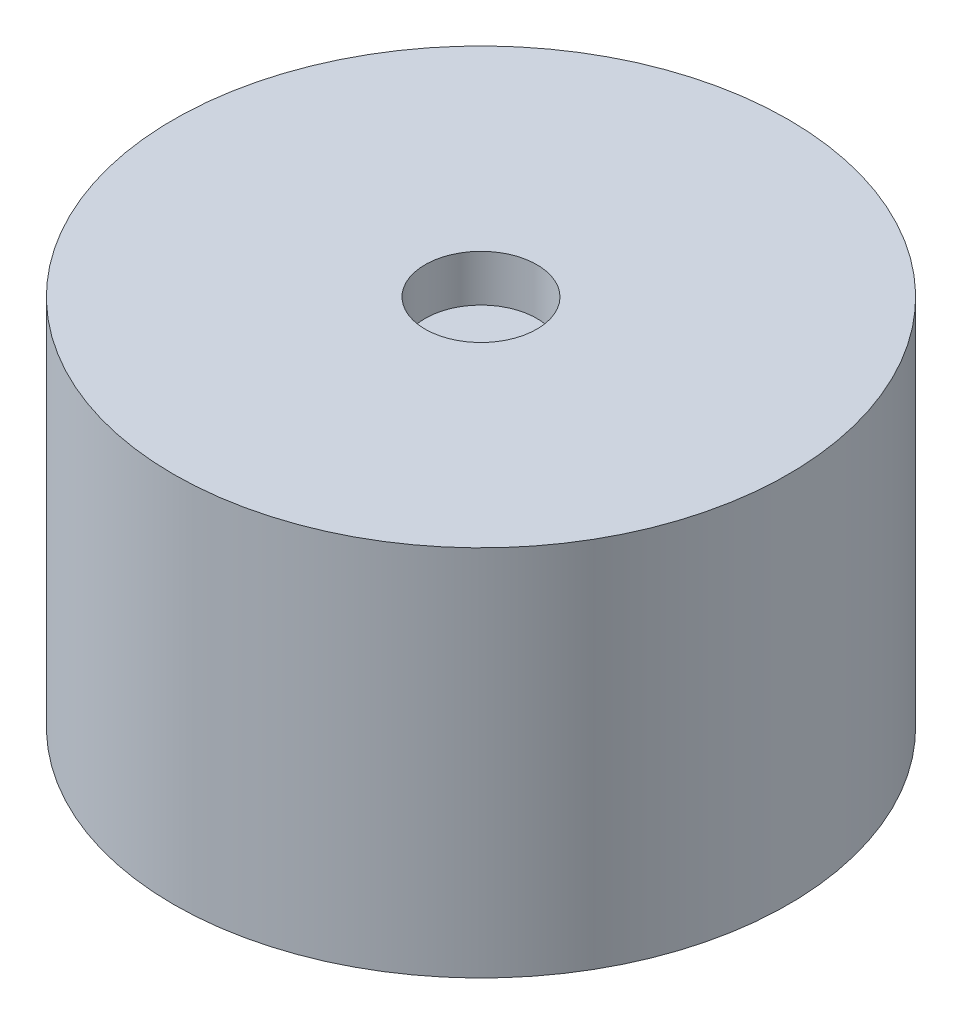
from build123d import *

# Parameters (mm, degrees)
SKETCH_1_R          = 33
EXTRUDE_1_DEPTH     = 40
SKETCH_2_R          = 6
CUT_EXTRUDE_1_DEPTH = 5


with BuildPart() as part:
    # 草图1 → 凸台-拉伸1 (new body)
    with BuildSketch(Plane(origin=(0, 0, 0), x_dir=(1, 0, 0), z_dir=(0, 1, 0))):
        with Locations(Location((0, 0, 0), (0, 0, 270))):
            Circle(SKETCH_1_R)
    extrude(amount=EXTRUDE_1_DEPTH)

    # 草图2 → 切除-拉伸1 (cut)
    with BuildSketch(Plane(origin=(0, 40, 0), x_dir=(1, 0, 0), z_dir=(0, 1, 0))):
        with Locations(Location((0, 0, 0), (0, 0, 270))):
            Circle(SKETCH_2_R)
    extrude(amount=-CUT_EXTRUDE_1_DEPTH, mode=Mode.SUBTRACT)


solid = part.part
